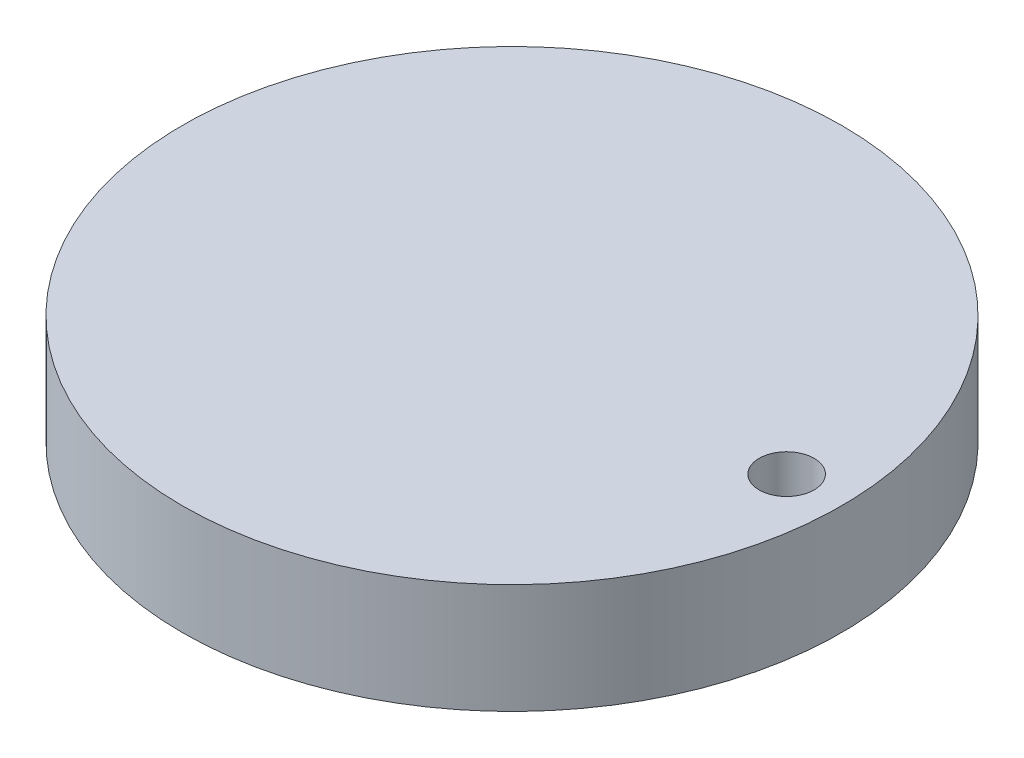
from build123d import *

# Parameters (mm, degrees)
SKETCH1_R           = 30
BOSS_EXTRUDE1_DEPTH = 10
SKETCH2_R           = 4.25
CUT_EXTRUDE1_DEPTH  = 7
SKETCH3_R           = 2.5
CUT_EXTRUDE2_DEPTH  = 6


with BuildPart() as part:
    # Sketch1 → Boss-Extrude1 (new body)
    with BuildSketch(Plane(origin=(0, 0, 0), x_dir=(1, 0, 0), z_dir=(0, 1, 0))):
        with Locations(Location((0, 0, 0), (0, 0, 270))):
            Circle(SKETCH1_R)
    extrude(amount=BOSS_EXTRUDE1_DEPTH)

    # Sketch2 → Cut-Extrude1 (cut)
    with BuildSketch(Plane.XZ):
        with Locations(Location((0, 0, 0), (0, 0, 270))):
            Circle(SKETCH2_R)
    extrude(amount=-CUT_EXTRUDE1_DEPTH, mode=Mode.SUBTRACT)

    # Sketch3 → Cut-Extrude2 (cut)
    with BuildSketch(Plane(origin=(0, 10, 0), x_dir=(1, 0, 0), z_dir=(0, 1, 0))):
        with Locations(Location((25, 0, 0), (0, 0, 270))):
            Circle(SKETCH3_R)
    extrude(amount=-CUT_EXTRUDE2_DEPTH, mode=Mode.SUBTRACT)


solid = part.part
